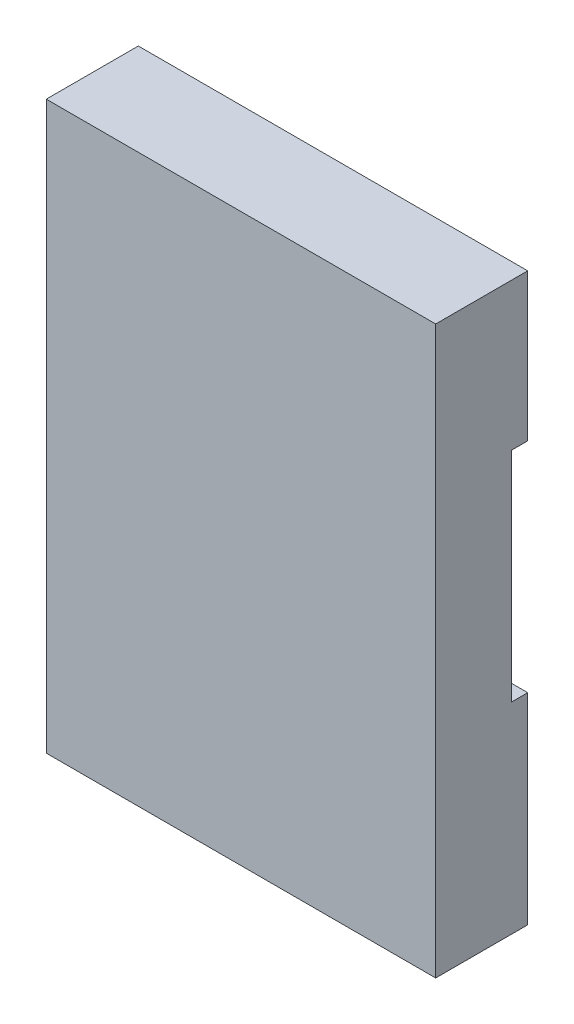
from build123d import *

# Parameters (mm, degrees)
SKETCH1_W           = 27.5
SKETCH1_H           = 40
BOSS_EXTRUDE1_DEPTH = 6.5
SKETCH2_W           = 17.25
SKETCH2_H           = 15.4
CUT_EXTRUDE1_DEPTH  = 1.15
SKETCH3_W           = 15.312161922
SKETCH3_H           = 2.25
CUT_EXTRUDE2_DEPTH  = 1.15


with BuildPart() as part:
    # Sketch1 → Boss-Extrude1 (new body)
    with BuildSketch(Plane.XY):
        Rectangle(SKETCH1_W, SKETCH1_H)
    extrude(amount=BOSS_EXTRUDE1_DEPTH)

    # Sketch2 → Cut-Extrude1 (cut)
    with BuildSketch(Plane(origin=(0, 0, 0), x_dir=(-1, 0, 0), z_dir=(0, 0, -1))):
        with Locations((-5.125, 1.9)):
            Rectangle(SKETCH2_W, SKETCH2_H)
    extrude(amount=-CUT_EXTRUDE1_DEPTH, mode=Mode.SUBTRACT)

    # Sketch3 → Cut-Extrude2 (cut)
    with BuildSketch(Plane(origin=(0, 0, 0), x_dir=(-1, 0, 0), z_dir=(0, 0, -1))):
        with Locations((0.219698945, -18.875)):
            Rectangle(SKETCH3_W, SKETCH3_H)
    extrude(amount=-CUT_EXTRUDE2_DEPTH, mode=Mode.SUBTRACT)


solid = part.part
